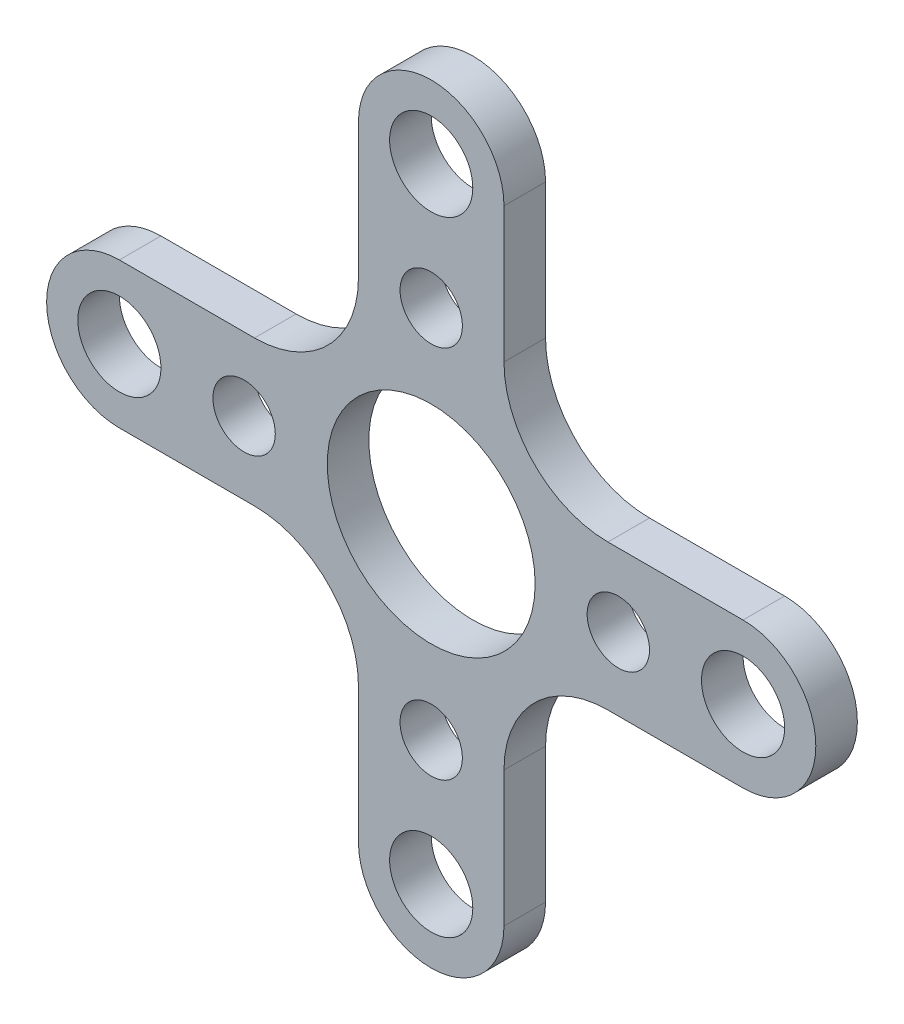
from build123d import *

# Parameters (mm, degrees)
ESQUISSE1_R        = 5
ESQUISSE1_R_2      = 1.5
ESQUISSE1_R_3      = 2
BOSS_EXTRU_1_DEPTH = 2


with BuildPart() as part:
    # Esquisse1 → Boss.-Extru.1 (new body)
    with BuildSketch(Plane.XY):
        with BuildLine():
            Line((18, -6.5), (18, -13))
            ThreePointArc((18, -13), (21.5, -16.5), (25, -13))
            Line((25, -13), (25, -6.5))
            ThreePointArc((25, -6.5), (26.464466094, -2.964466094), (30, -1.5))
            Line((30, -1.5), (36.5, -1.5))
            ThreePointArc((36.5, -1.5), (40, 2), (36.5, 5.5))
            Line((36.5, 5.5), (30, 5.5))
            ThreePointArc((30, 5.5), (26.464466094, 6.964466094), (25, 10.5))
            Line((25, 10.5), (25, 17))
            ThreePointArc((25, 17), (21.5, 20.5), (18, 17))
            Line((18, 17), (18, 10.5))
            ThreePointArc((18, 10.5), (16.535533906, 6.964466094), (13, 5.5))
            Line((13, 5.5), (6.5, 5.5))
            ThreePointArc((6.5, 5.5), (3, 2), (6.5, -1.5))
            Line((6.5, -1.5), (13, -1.5))
            ThreePointArc((13, -1.5), (16.535533906, -2.964466094), (18, -6.5))
        make_face()
        with Locations((21.5, 2)):
            Circle(ESQUISSE1_R, mode=Mode.SUBTRACT)
        with Locations((12.5, 2)):
            Circle(ESQUISSE1_R_2, mode=Mode.SUBTRACT)
        with Locations((6.5, 2)):
            Circle(ESQUISSE1_R_3, mode=Mode.SUBTRACT)
        with Locations((21.5, 17)):
            Circle(ESQUISSE1_R_3, mode=Mode.SUBTRACT)
        with Locations((21.5, 11)):
            Circle(ESQUISSE1_R_2, mode=Mode.SUBTRACT)
        with Locations((36.5, 2)):
            Circle(ESQUISSE1_R_3, mode=Mode.SUBTRACT)
        with Locations((30.5, 2)):
            Circle(ESQUISSE1_R_2, mode=Mode.SUBTRACT)
        with Locations((21.5, -13)):
            Circle(ESQUISSE1_R_3, mode=Mode.SUBTRACT)
        with Locations((21.5, -7)):
            Circle(ESQUISSE1_R_2, mode=Mode.SUBTRACT)
    extrude(amount=BOSS_EXTRU_1_DEPTH)


solid = part.part
